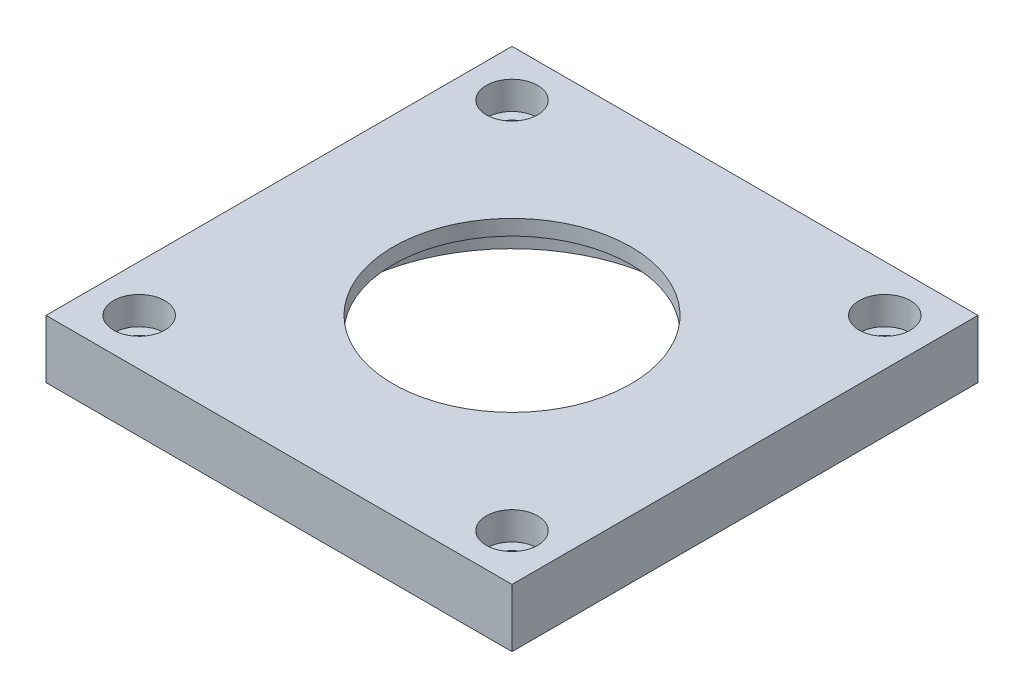
from build123d import *

# Parameters (mm, degrees)
CROQUIS1_W              = 100
CROQUIS1_H              = 100
SALIENTE_EXTRUIR1_DEPTH = 12.5
CROQUIS3_R              = 35.2
CORTAR_EXTRUIR1_DEPTH   = 9.2
CROQUIS4_R              = 25.5
CORTAR_EXTRUIR2_DEPTH   = 72.30666168
CROQUIS5_R              = 3.25
CORTAR_EXTRUIR3_DEPTH   = 72.807033082
MATRIZC1_COUNT          = 4
CROQUIS6_R              = 5.5
CORTAR_EXTRUIR4_DEPTH   = 6
MATRIZC2_COUNT          = 4


with BuildPart() as part:
    # Croquis1 → Saliente-Extruir1 (new body)
    with BuildSketch(Plane(origin=(0, 0, 0), x_dir=(1, 0, 0), z_dir=(0, 1, 0))):
        Rectangle(CROQUIS1_W, CROQUIS1_H)
    extrude(amount=SALIENTE_EXTRUIR1_DEPTH)

    # Croquis3 → Cortar-Extruir1 (cut)
    with BuildSketch(Plane.XZ):
        with Locations(Location((0, 0, 0), (0, 0, 270))):
            Circle(CROQUIS3_R)
    extrude(amount=-CORTAR_EXTRUIR1_DEPTH, mode=Mode.SUBTRACT)

    # Croquis4 → Cortar-Extruir2 (cut, through all)
    with BuildSketch(Plane.XZ.offset(-9.2)):
        with Locations(Location((0, 0, 0), (0, 0, 270))):
            Circle(CROQUIS4_R)
    extrude(amount=-CORTAR_EXTRUIR2_DEPTH, mode=Mode.SUBTRACT)

    # Croquis5 → Cortar-Extruir3 (cut, through all)
    with BuildSketch(Plane.XZ):
        with Locations(Location((-40, 40, 0), (0, 0, 270))):
            Circle(CROQUIS5_R)
    cortar_extruir3 = extrude(amount=-CORTAR_EXTRUIR3_DEPTH, mode=Mode.SUBTRACT)

    # MatrizC1: Cortar-Extruir3 ×4 about axis
    matrizc1_axis = Axis((0, 0, 0), (0, 1, 0))
    for i in range(1, MATRIZC1_COUNT):
        add(cortar_extruir3.rotate(matrizc1_axis, i * 360 / MATRIZC1_COUNT), mode=Mode.SUBTRACT)

    # Croquis6 → Cortar-Extruir4 (cut)
    with BuildSketch(Plane(origin=(0, 12.5, 0), x_dir=(1, 0, 0), z_dir=(0, 1, 0))):
        with Locations(Location((-40, 40, 0), (0, 0, 270))):
            Circle(CROQUIS6_R)
    cortar_extruir4 = extrude(amount=-CORTAR_EXTRUIR4_DEPTH, mode=Mode.SUBTRACT)

    # MatrizC2: Cortar-Extruir4 ×4 about axis
    matrizc2_axis = Axis((0, 0, 0), (0, 1, 0))
    for i in range(1, MATRIZC2_COUNT):
        add(cortar_extruir4.rotate(matrizc2_axis, i * 360 / MATRIZC2_COUNT), mode=Mode.SUBTRACT)


solid = part.part
